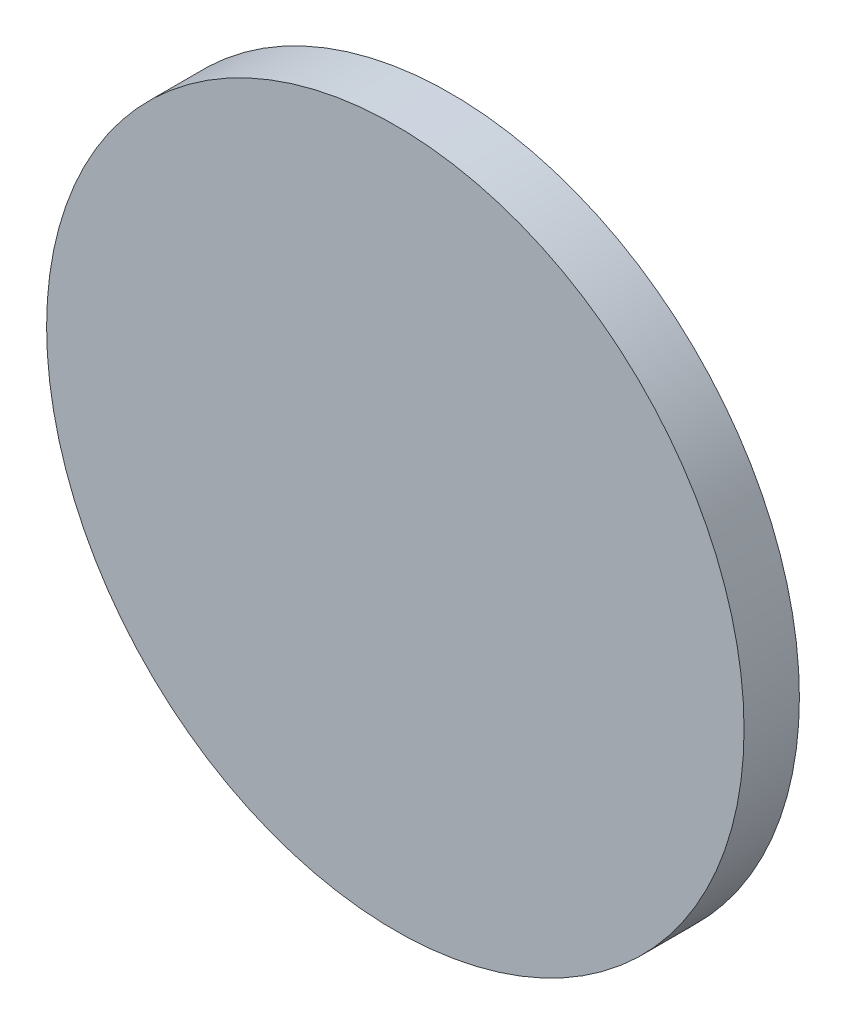
from build123d import *

# Parameters (mm, degrees)
CURVESKETCH_R   = 73.913
CURVEBOSS_DEPTH = 11.731


with BuildPart() as part:
    # CurveSketch → CurveBoss (new body)
    with BuildSketch(Plane.XY):
        with Locations((-3.719, 5.173)):
            Circle(CURVESKETCH_R)
    extrude(amount=CURVEBOSS_DEPTH)


solid = part.part
